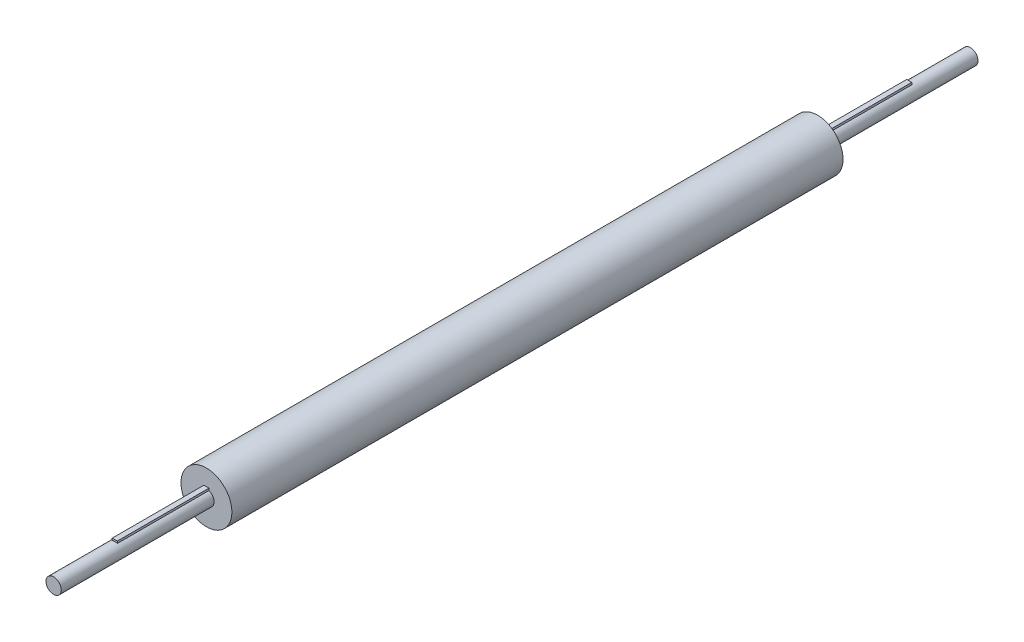
from build123d import *
from build123d.topology import SkipClean

# Parameters (mm, degrees)
BOSS_EXTRUDE4_DEPTH = 800
SKETCH6_R           = 50
BOSS_EXTRUDE5_DEPTH = 600
BOSS_EXTRUDE6_START = 900
SKETCH7_R           = 15
BOSS_EXTRUDE6_DEPTH = 100
CUT_EXTRUDE1_DEPTH  = 20
CUT_EXTRUDE2_START  = -20
CUT_EXTRUDE2_DEPTH  = 20


with BuildPart() as part:
    # Sketch4 → Boss-Extrude4 (new, symmetric)
    with BuildSketch(Plane.XY):
        with BuildLine():
            Line((-5, 14.142135624), (-5, 18.3))
            Line((-5, 18.3), (5, 18.3))
            Line((5, 18.3), (5, 14.142135624))
            ThreePointArc((5, 14.142135624), (0, -15), (-5, 14.142135624))
        make_face()
    extrude(amount=BOSS_EXTRUDE4_DEPTH, both=True)

    # Sketch6 → Boss-Extrude5 (add, symmetric)
    with BuildSketch(Plane.XY):
        Circle(SKETCH6_R)
    extrude(amount=BOSS_EXTRUDE5_DEPTH, both=True)

    # Sketch7 → Boss-Extrude6 (add)
    with BuildSketch(Plane.XY.offset(BOSS_EXTRUDE6_START)):
        Circle(SKETCH7_R)
    boss_extrude6 = extrude(amount=-BOSS_EXTRUDE6_DEPTH)

    # Mirror1: Boss-Extrude6 across plane
    add(boss_extrude6.mirror(Plane.XY))

    # Sketch8 → Cut-Extrude1 (cut)
    with BuildSketch(Plane.XY.offset(800)):
        with BuildLine():
            Line((5, 14.142135624), (5, 18.3))
            Line((5, 18.3), (-5, 18.3))
            Line((-5, 18.3), (-5, 14.142135624))
            ThreePointArc((-5, 14.142135624), (0, 15), (5, 14.142135624))
        make_face()
    extrude(amount=-CUT_EXTRUDE1_DEPTH, mode=Mode.SUBTRACT)

    # Sketch9 → Cut-Extrude2 (cut)
    with SkipClean():  # the faces are left unmerged after this step: merging them gives an invalid solid
        with BuildSketch(Plane(origin=(0, 0, -800), x_dir=(-1, 0, 0), z_dir=(0, 0, -1)).offset(CUT_EXTRUDE2_START)):
            with BuildLine():
                Line((-5, 18.3), (-5, 14.142135624))
                ThreePointArc((-5, 14.142135624), (0, 15), (5, 14.142135624))
                Line((5, 14.142135624), (5, 18.3))
                Line((5, 18.3), (-5, 18.3))
            make_face()
        extrude(amount=CUT_EXTRUDE2_DEPTH, mode=Mode.SUBTRACT)


solid = part.part
